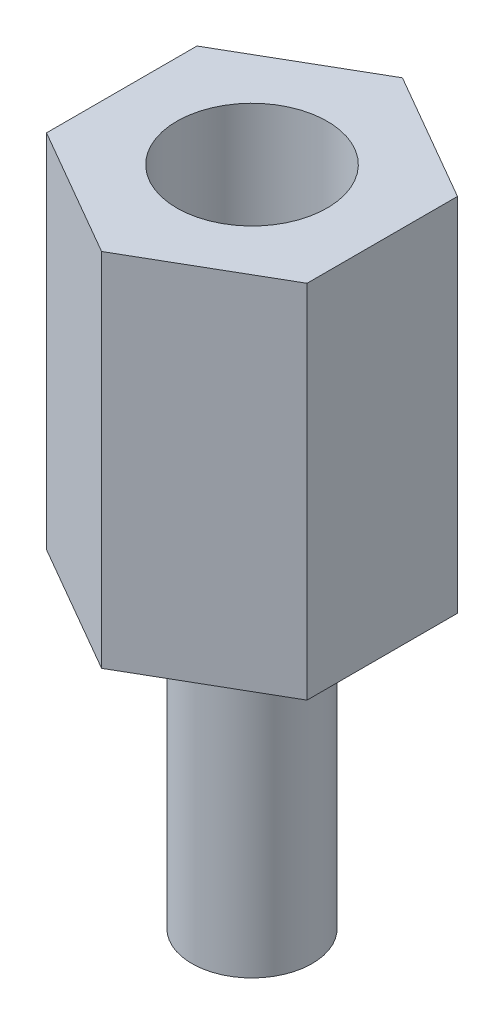
from build123d import *

# Parameters (mm, degrees)
SKETCH1_R   = 1.25
BODY_DEPTH  = 5
END_DEPTH   = 1
SKETCH3_R   = 1
SCREW_DEPTH = 5


with BuildPart() as part:
    # Sketch1 → Body (new body)
    with BuildSketch(Plane(origin=(0, 0, 0), x_dir=(1, 0, 0), z_dir=(0, 1, 0))):
        Polygon((0, 2.5), (-2.165063509, 1.25), (-2.165063509, -1.25), (0, -2.5), (2.165063509, -1.25), (2.165063509, 1.25), align=None)
        with Locations(Location((0, 0, 0), (0, 0, 270))):
            Circle(SKETCH1_R, mode=Mode.SUBTRACT)
    extrude(amount=BODY_DEPTH)

    # Sketch2 → End (add)
    with BuildSketch(Plane.XZ):
        Polygon((0, -2.5), (2.165063509, -1.25), (2.165063509, 1.25), (0, 2.5), (-2.165063509, 1.25), (-2.165063509, -1.25), align=None)
    extrude(amount=END_DEPTH)

    # Sketch3 → Screw (add)
    with BuildSketch(Plane.XZ.offset(1)):
        with Locations(Location((0, 0, 0), (0, 0, 270))):
            Circle(SKETCH3_R)
    extrude(amount=SCREW_DEPTH)


solid = part.part
